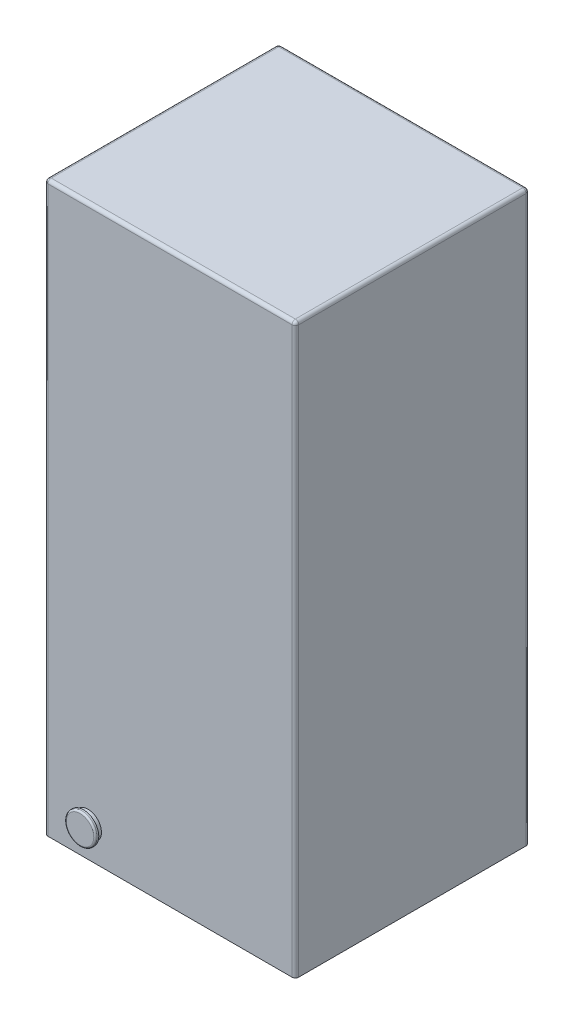
from build123d import *

# Parameters (mm, degrees)
CROQUIS1_W              = 750
CROQUIS1_H              = 1700
SALIENTE_EXTRUIR1_DEPTH = 700
REDONDEO1_R             = 10
CROQUIS2_R              = 40
SALIENTE_EXTRUIR2_DEPTH = 24
CROQUIS3_R              = 46
SALIENTE_EXTRUIR3_DEPTH = 10
REDONDEO2_R             = 5


with BuildPart() as part:
    # Croquis1 → Saliente-Extruir1 (new body)
    with BuildSketch(Plane.XY):
        with Locations((375, -850)):
            Rectangle(CROQUIS1_W, CROQUIS1_H)
    extrude(amount=SALIENTE_EXTRUIR1_DEPTH)

    # Redondeo1
    redondeo1_edges = [part.edges().sort_by_distance(p)[0] for p in [
        (750, -850, 700),
        (375, 0, 700),
        (0, -850, 700),
        (375, 0, 0),
        (750, -850, 0),
        (0, -850, 0),
        (0, 0, 350),
        (750, 0, 350),
    ]]
    fillet(redondeo1_edges, radius=REDONDEO1_R)

    # Croquis2 → Saliente-Extruir2 (add)
    with BuildSketch(Plane.XY.offset(700)):
        with Locations((130, -1610)):
            Circle(CROQUIS2_R)
    extrude(amount=SALIENTE_EXTRUIR2_DEPTH)

    # Croquis3 → Saliente-Extruir3 (add)
    with BuildSketch(Plane.XY.offset(724)):
        with Locations((130, -1610)):
            Circle(CROQUIS3_R)
    extrude(amount=-SALIENTE_EXTRUIR3_DEPTH)

    # Redondeo2
    redondeo2_edges = [part.edges().sort_by_distance(p)[0] for p in [
        (84, -1610, 724),
    ]]
    fillet(redondeo2_edges, radius=REDONDEO2_R)


solid = part.part
